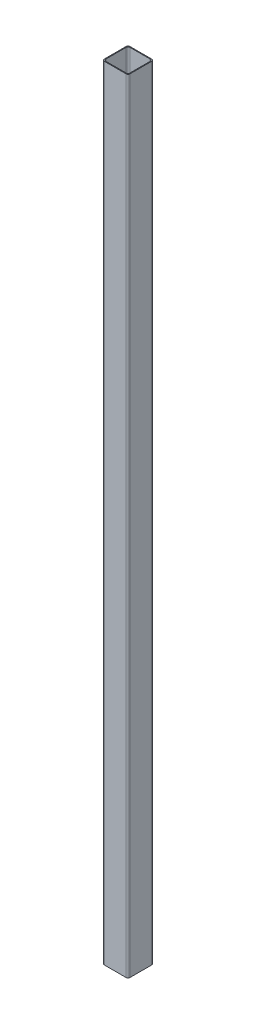
from build123d import *

# Parameters (mm, degrees)
ESBO_O1_W                = 40
ESBO_O1_H                = 40
ESBO_O1_W_2              = 37.6
ESBO_O1_H_2              = 37.6
RESSALTO_EXTRUS_O1_DEPTH = 610
FILETE1_R                = 3


with BuildPart() as part:
    # Esboço1 → Ressalto-extrusão1 (new, symmetric)
    with BuildSketch(Plane(origin=(0, 0, 0), x_dir=(1, 0, 0), z_dir=(0, 1, 0))):
        Rectangle(ESBO_O1_W, ESBO_O1_H)
        Rectangle(ESBO_O1_W_2, ESBO_O1_H_2, mode=Mode.SUBTRACT)
    extrude(amount=RESSALTO_EXTRUS_O1_DEPTH, both=True)

    # Filete1
    filete1_edges = [part.edges().sort_by_distance(p)[0] for p in [
        (-18.8, 0, 18.8),
        (18.8, 0, 18.8),
        (18.8, 0, -18.8),
        (-18.8, 0, -18.8),
        (-20, 0, -20),
        (20, 0, -20),
        (20, 0, 20),
        (-20, 0, 20),
    ]]
    fillet(filete1_edges, radius=FILETE1_R)


solid = part.part
